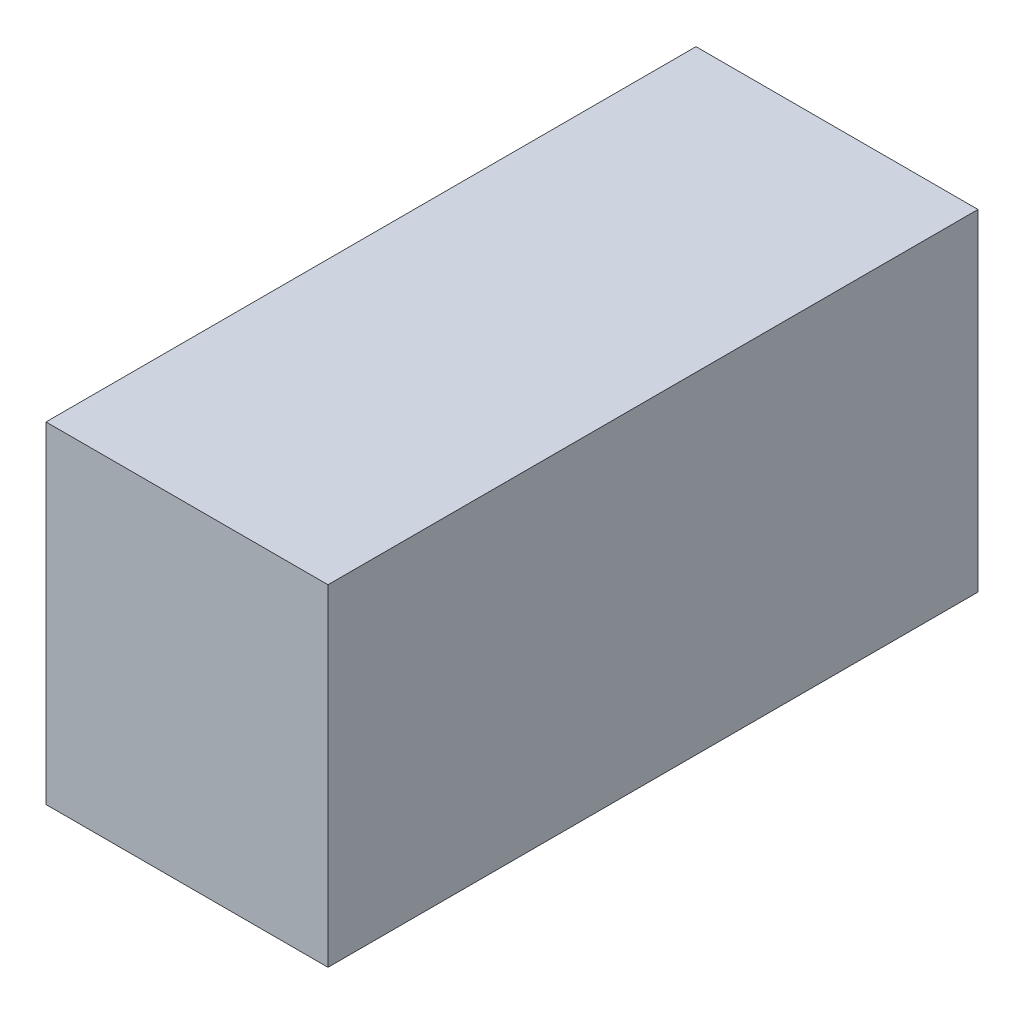
from build123d import *

# Parameters (mm, degrees)
SKETCH1_W      = 20
SKETCH1_H      = 23.5
ENVELOPE_DEPTH = 46.1


with BuildPart() as part:
    # Sketch1 → Envelope (new body)
    with BuildSketch(Plane.XY):
        Rectangle(SKETCH1_W, SKETCH1_H)
    extrude(amount=ENVELOPE_DEPTH)


solid = part.part
